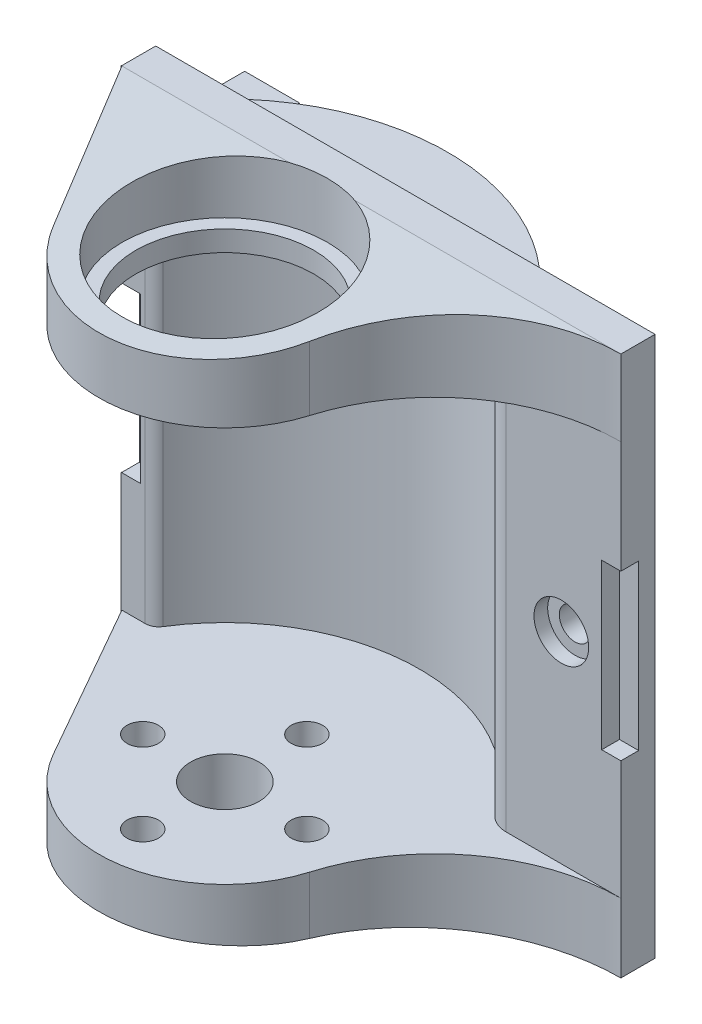
from build123d import *

# Parameters (mm, degrees)
SKETCH_1_R               = 16.3
EXTRUDE_1_DEPTH          = 19.75
SKETCH_2_W               = 36.5
SKETCH_2_H               = 2.5
EXTRUDE_2_DEPTH          = 39.5
SKETCH_3_W               = 44.844436064
SKETCH_3_H               = 25.506740045
CUT_EXTRUDE_1_DEPTH      = 50
EXTRUDE_3_DEPTH          = 5.05
SKETCH_5_R               = 14.25
CUT_EXTRUDE_2_DEPTH      = 29.4
SKETCH_6_R               = 2.5
CUT_EXTRUDE_3_DEPTH      = 44.930797853
CUT_EXTRUDE_6_REACH      = 49.993
SKETCH_9_R               = 7.5
SKETCH_12_R              = 1.15
CUT_EXTRUDE_9_DEPTH      = 34.662664779
SKETCH_13_R              = 2
CUT_EXTRUDE_10_DEPTH     = 1
SKETCH_14_W              = 2.8
SKETCH_14_H              = 12
CUT_EXTRUDE_11_DEPTH     = 1.3
SKETCH_15_W              = 2.8
SKETCH_15_H              = 12
CUT_EXTRUDE_12_DEPTH     = 1.3
EXTRUDE_5_REACH          = 40.183
EXTRUDE_5_END_RADIUS     = 16.3
SKETCH_16_W              = 4
SKETCH_16_H              = 5
SKETCH_17_W              = 1
SKETCH_17_H              = 2
CUT_EXTRUDE_13_DEPTH     = 2.5
SKETCH_19_R              = 8.51898124
SKETCH_19_R_2            = 6.5
EXTRUDE_6_DEPTH          = 2.25
CUT_EXTRUDE_18_REACH     = 49.993
SKETCH_20_R              = 1.15
PATTERN_CIRCULAR_1_COUNT = 4
CUT_EXTRUDE_8_DEPTH      = 45.587021654
SKETCH_18_W              = 26.346157216
SKETCH_18_H              = 2.75
CUT_EXTRUDE_16_DEPTH     = 12.5
FILLET_1_R               = 2
FILLET_2_R               = 1
SKETCH_21_R              = 2.1
CUT_EXTRUDE_19_DEPTH     = 2.5
CUT_EXTRUDE_START        = -10
SKETCH_22_R              = 7.5
CUT_EXTRUDE_23_DEPTH     = 10
EXTRUDE_START            = -1
SKETCH_23_R              = 7.5
SKETCH_23_R_2            = 6.5
EXTRUDE_7_DEPTH          = 1
MOVE_FACE_3_BY           = 0.5


with BuildPart() as part:
    # 草图1 → 凸台-拉伸1 (new, symmetric)
    with BuildSketch(Plane(origin=(0, 0, 0), x_dir=(1, 0, 0), z_dir=(0, 1, 0))):
        with Locations(Location((0, 0, 0), (0, 0, 270))):
            Circle(SKETCH_1_R)
    extrude(amount=EXTRUDE_1_DEPTH, both=True)

    # 草图2 → 凸台-拉伸2 (add, through all)
    with BuildSketch(Plane.XZ.offset(19.75)):
        with Locations((3.6, -8.35)):
            Rectangle(SKETCH_2_W, SKETCH_2_H)
    extrude(amount=-EXTRUDE_2_DEPTH)

    # 草图3 → 切除-拉伸1 (cut)
    with BuildSketch(Plane.XZ.offset(19.75)):
        with Locations((-0.572218032, 5.653370022)):
            Rectangle(SKETCH_3_W, SKETCH_3_H)
    extrude(amount=-CUT_EXTRUDE_1_DEPTH, mode=Mode.SUBTRACT)

    # 草图4 → 凸台-拉伸3 (add)
    with BuildSketch(Plane.XZ.offset(19.75)):
        with BuildLine():
            Line((-14.65, -7.146152811), (-7.996542478, 4.549209646))
            ThreePointArc((-7.996542478, 4.549209646), (1.047927533, 9.140122969), (8.818653972, 2.621324497))
            ThreePointArc((8.818653972, 2.621324497), (13.721037439, -4.401937543), (21.85, -7.1))
            Line((21.85, -7.1), (-14.65, -7.146152811))
        make_face()
    extrude_3 = extrude(amount=-EXTRUDE_3_DEPTH)

    # 镜向1: 凸台-拉伸3 across plane
    add(extrude_3.mirror(Plane.ZX))

    # 草图5 → 切除-拉伸2 (cut)
    with BuildSketch(Plane(origin=(0, -14.7, 0), x_dir=(1, 0, 0), z_dir=(0, 1, 0))):
        Circle(SKETCH_5_R)
    extrude(amount=CUT_EXTRUDE_2_DEPTH, mode=Mode.SUBTRACT)

    # 草图6 → 切除-拉伸3 (cut, through all)
    with BuildSketch(Plane(origin=(0, -14.7, 0), x_dir=(1, 0, 0), z_dir=(0, 1, 0))):
        with Locations(Location((0, 0, 0), (0, 0, 270))):
            Circle(SKETCH_6_R)
    extrude(amount=-CUT_EXTRUDE_3_DEPTH, mode=Mode.SUBTRACT)

    # 草图9 → 切除-拉伸6 (cut, up to next)
    with BuildSketch(Plane(origin=(0, 19.75, 0), x_dir=(1, 0, 0), z_dir=(0, 1, 0)), mode=Mode.PRIVATE) as cut_extrude_6_sk1:
        with Locations(Location((0, 0, 0), (0, 0, 270))):
            Circle(SKETCH_9_R)
    cut_extrude_6_tool1 = extrude(cut_extrude_6_sk1.sketch, amount=-CUT_EXTRUDE_6_REACH, mode=Mode.PRIVATE) & part.part
    add(cut_extrude_6_tool1.solids().sort_by_distance((0, 19.75, 0))[0], mode=Mode.SUBTRACT)

    # 草图12 → 切除-拉伸9 (cut, through all)
    with BuildSketch(Plane.XY.offset(-7.1)):
        with Locations((17.5, 0)):
            Circle(SKETCH_12_R)
    extrude(amount=-CUT_EXTRUDE_9_DEPTH, mode=Mode.SUBTRACT)

    # 草图13 → 切除-拉伸10 (cut)
    with BuildSketch(Plane.XY.offset(-7.1)):
        with Locations((17.5, 0)):
            Circle(SKETCH_13_R)
    extrude(amount=-CUT_EXTRUDE_10_DEPTH, mode=Mode.SUBTRACT)

    # 草图14 → 切除-拉伸11 (cut)
    with BuildSketch(Plane.XY.offset(-7.1)):
        with Locations((21.85, 0)):
            Rectangle(SKETCH_14_W, SKETCH_14_H)
    extrude(amount=-CUT_EXTRUDE_11_DEPTH, mode=Mode.SUBTRACT)

    # 草图15 → 切除-拉伸12 (cut)
    with BuildSketch(Plane.XY.offset(-7.1)):
        with Locations((-14.672423113, 0)):
            Rectangle(SKETCH_15_W, SKETCH_15_H)
    extrude(amount=-CUT_EXTRUDE_12_DEPTH, mode=Mode.SUBTRACT)

    # 凸台-拉伸5: up to this cylinder (the profile starts outside it)
    extrude_5_end = Plane(origin=(0, 13.4, 0), z_dir=(0, -1, 0)) * Cylinder(EXTRUDE_5_END_RADIUS, 113.966, mode=Mode.PRIVATE)
    # 草图16 → 凸台-拉伸5 (add, up to the surface)
    with BuildSketch(Plane(origin=(0, 0, -15.1), x_dir=(-1, 0, 0), z_dir=(0, 0, -1)), mode=Mode.PRIVATE) as extrude_5_sk1:
        with Locations((11.65, 13.4)):
            Rectangle(SKETCH_16_W, SKETCH_16_H)
    extrude_5_tool1 = extrude(extrude_5_sk1.sketch, amount=-EXTRUDE_5_REACH, mode=Mode.PRIVATE) - extrude_5_end
    extrude_5 = extrude_5_tool1.solids().sort_by_distance((-11.65, 13.4, -15.1))[0]
    add(extrude_5)

    # 镜向4: 凸台-拉伸5 across plane
    add(extrude_5.mirror(Plane.ZX))

    # 草图17 → 切除-拉伸13 (cut)
    with BuildSketch(Plane(origin=(0, 0, -15.1), x_dir=(-1, 0, 0), z_dir=(0, 0, -1))):
        with Locations((11.65, 13.4)):
            Rectangle(SKETCH_17_W, SKETCH_17_H)
    cut_extrude_13 = extrude(amount=-CUT_EXTRUDE_13_DEPTH, mode=Mode.SUBTRACT)

    # 镜向5: 切除-拉伸13 across plane
    add(cut_extrude_13.mirror(Plane.ZX), mode=Mode.SUBTRACT)

    # 草图19 → 凸台-拉伸6 (add)
    with BuildSketch(Plane(origin=(0, 19.75, 0), x_dir=(1, 0, 0), z_dir=(0, 1, 0))):
        Circle(SKETCH_19_R)
        with Locations(Location((0, 0, 0), (0, 0, 270))):
            Circle(SKETCH_19_R_2, mode=Mode.SUBTRACT)
    extrude(amount=-EXTRUDE_6_DEPTH)

    # 草图20 → 切除-拉伸18 (cut, up to next)
    with BuildSketch(Plane.XZ.offset(19.75), mode=Mode.PRIVATE) as cut_extrude_18_sk1:
        with Locations(Location((0, 6, 0), (0, 0, 270))):
            Circle(SKETCH_20_R)
    cut_extrude_18_tool1 = extrude(cut_extrude_18_sk1.sketch, amount=-CUT_EXTRUDE_18_REACH, mode=Mode.PRIVATE) & part.part
    cut_extrude_18 = cut_extrude_18_tool1.solids().sort_by_distance((0, -19.75, 6))[0]
    add(cut_extrude_18, mode=Mode.SUBTRACT)

    # 阵列(圆周)1: 切除-拉伸18 ×4 about axis
    pattern_circular_1_axis = Axis((0, 0, 0), (0, 1, 0))
    for i in range(1, PATTERN_CIRCULAR_1_COUNT):
        add(cut_extrude_18.rotate(pattern_circular_1_axis, i * 360 / PATTERN_CIRCULAR_1_COUNT), mode=Mode.SUBTRACT)

    # 草图7 → 切除-拉伸8 (cut, through all)
    with BuildSketch(Plane.ZY.offset(14.65)):
        Polygon((-7.1, 19.75), (9.2, 18.323934785), (9.2, 19.75), align=None)
    cut_extrude_8 = extrude(amount=-CUT_EXTRUDE_8_DEPTH, mode=Mode.SUBTRACT)

    # 镜向3: 切除-拉伸8 across plane
    add(cut_extrude_8.mirror(Plane.ZX), mode=Mode.SUBTRACT)

    # 草图18 → 切除-拉伸16 (cut)
    with BuildSketch(Plane(origin=(0, 0, -9.6), x_dir=(-1, 0, 0), z_dir=(0, 0, -1))):
        with Locations((0, 18.375)):
            Rectangle(SKETCH_18_W, SKETCH_18_H)
    cut_extrude_16 = extrude(amount=CUT_EXTRUDE_16_DEPTH, mode=Mode.SUBTRACT)

    # 镜向6: 切除-拉伸16 across plane
    add(cut_extrude_16.mirror(Plane.ZX), mode=Mode.SUBTRACT)

    # 圆角1
    fillet_1_edges = [part.edges().sort_by_distance(p)[0] for p in [
        (12.355262037, 0, -7.1),
    ]]
    fillet(fillet_1_edges, radius=FILLET_1_R)

    # 圆角2
    fillet_2_edges = [part.edges().sort_by_distance(p)[0] for p in [
        (-12.355262037, 0, -7.1),
    ]]
    fillet(fillet_2_edges, radius=FILLET_2_R)

    # 草图21 → 切除-拉伸19 (cut)
    with BuildSketch(Plane.XZ.offset(19.75)):
        with Locations(Location((0, 6, 0), (0, 0, 270))):
            Circle(SKETCH_21_R)
        with Locations(Location((-6, 0, 0), (0, 0, 270))):
            Circle(SKETCH_21_R)
        with Locations(Location((6, 0, 0), (0, 0, 270))):
            Circle(SKETCH_21_R)
        with Locations(Location((0, -6, 0), (0, 0, 270))):
            Circle(SKETCH_21_R)
    extrude(amount=-CUT_EXTRUDE_19_DEPTH, mode=Mode.SUBTRACT)

    # 草图22 → 切除-拉伸23 (cut)
    with BuildSketch(Plane.XZ.offset(-17.5).offset(CUT_EXTRUDE_START)):
        with Locations(Location((0, 0, 0), (0, 0, 90))):
            Circle(SKETCH_22_R)
    extrude(amount=CUT_EXTRUDE_23_DEPTH, mode=Mode.SUBTRACT)

    # 草图23 → 凸台-拉伸7 (add)
    with BuildSketch(Plane.XZ.offset(-14.7).offset(EXTRUDE_START)):
        with Locations(Location((0, 0, 0), (0, 0, 288.796905035))):
            Circle(SKETCH_23_R)
        with Locations(Location((0, 0, 0), (0, 0, 270))):
            Circle(SKETCH_23_R_2, mode=Mode.SUBTRACT)
    extrude(amount=EXTRUDE_7_DEPTH)

    # Move Face 3: a face moved outward by 0.5
    extrude(part.faces().sort_by_distance((3.6131281, 14.7, -8.3875))[0], amount=MOVE_FACE_3_BY, dir=(0, -1, 0))


solid = part.part
